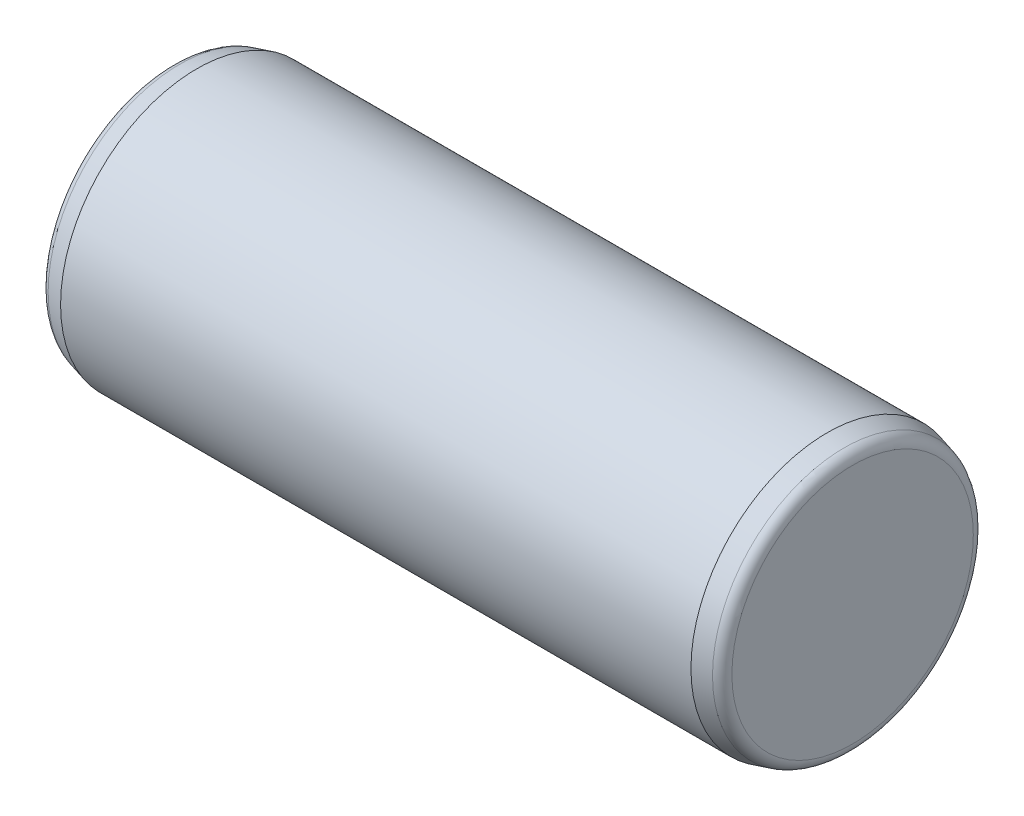
from build123d import *

# Parameters (mm, degrees)
FILLET1_R = 0.5


with BuildPart() as part:
    # Sketch1 → Revolve1 (revolve)
    with BuildSketch(Plane.XY, mode=Mode.PRIVATE) as revolve1_sk:
        Polygon((0, 0), (0, 5.7), (1.119615242, 6), (28.880384758, 6), (30, 5.7), (30, 0), align=None)
    revolve(revolve1_sk.sketch.rotate(Axis((0, 0, 0), (1, 0, 0)), 90), axis=Axis((0, 0, 0), (1, 0, 0)))

    # Fillet1
    fillet1_edges = [part.edges().sort_by_distance(p)[0] for p in [
        (30, 0, -5.7),
        (0, 0, -5.7),
    ]]
    fillet(fillet1_edges, radius=FILLET1_R)


solid = part.part
